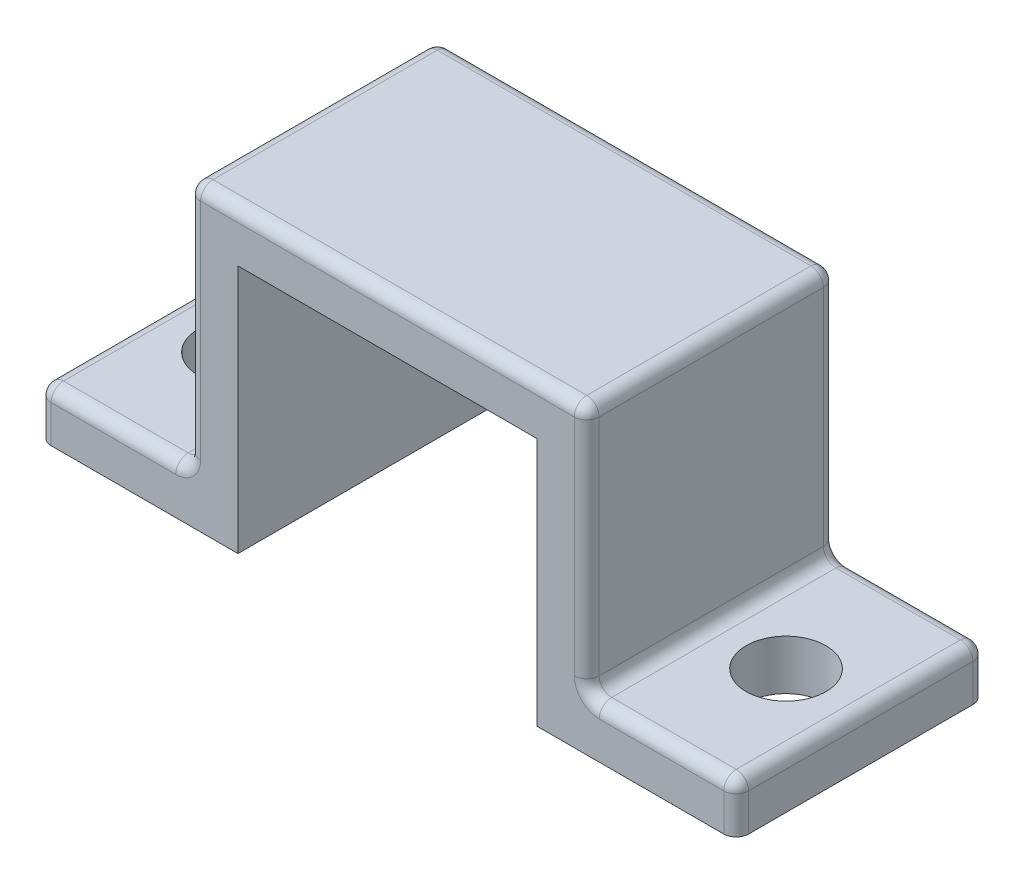
from build123d import *

# Parameters (mm, degrees)
GRUNDK_RPER_DEPTH      = 10
SKIZZE2_W              = 12
SKIZZE2_H              = 10
AUSSCHNITT_MITTE_DEPTH = 21.976176963
SKIZZE3_R              = 1.6
BOHRUNGEN_DEPTH        = 20.899748742
VERRUNDUNG1_R          = 0.5


with BuildPart() as part:
    # Skizze1 → Grundkörper (new body)
    with BuildSketch(Plane.XY):
        Polygon((14, 0), (-14, 0), (-14, 2), (-8, 2), (-8, 12), (8, 12), (8, 2), (14, 2), align=None)
    extrude(amount=GRUNDK_RPER_DEPTH)

    # Skizze2 → Ausschnitt_Mitte (cut, through all)
    with BuildSketch(Plane.XY.offset(10)):
        with Locations((0, 5)):
            Rectangle(SKIZZE2_W, SKIZZE2_H)
    extrude(amount=-AUSSCHNITT_MITTE_DEPTH, mode=Mode.SUBTRACT)

    # Skizze3 → Bohrungen (cut, through all)
    with BuildSketch(Plane(origin=(0, 2, 0), x_dir=(1, 0, 0), z_dir=(0, 1, 0))):
        with Locations(Location((-11, -5, 0), (0, 0, 270))):
            Circle(SKIZZE3_R)
        with Locations(Location((11, -5, 0), (0, 0, 90))):
            Circle(SKIZZE3_R)
    extrude(amount=-BOHRUNGEN_DEPTH, mode=Mode.SUBTRACT)

    # Verrundung1
    verrundung1_edges = [part.edges().sort_by_distance(p)[0] for p in [
        (0, 12, 10),
        (8, 7, 0),
        (11, 2, 0),
        (-8, 7, 10),
        (14, 2, 5),
        (-14, 2, 5),
        (-8, 2, 5),
        (-8, 12, 5),
        (8, 12, 5),
        (8, 2, 5),
        (-11, 2, 10),
        (-14, 1, 10),
        (14, 1, 10),
        (11, 2, 10),
        (8, 7, 10),
        (14, 1, 0),
        (-14, 1, 0),
        (-11, 2, 0),
        (-8, 7, 0),
        (0, 12, 0),
    ]]
    fillet(verrundung1_edges, radius=VERRUNDUNG1_R)


solid = part.part
